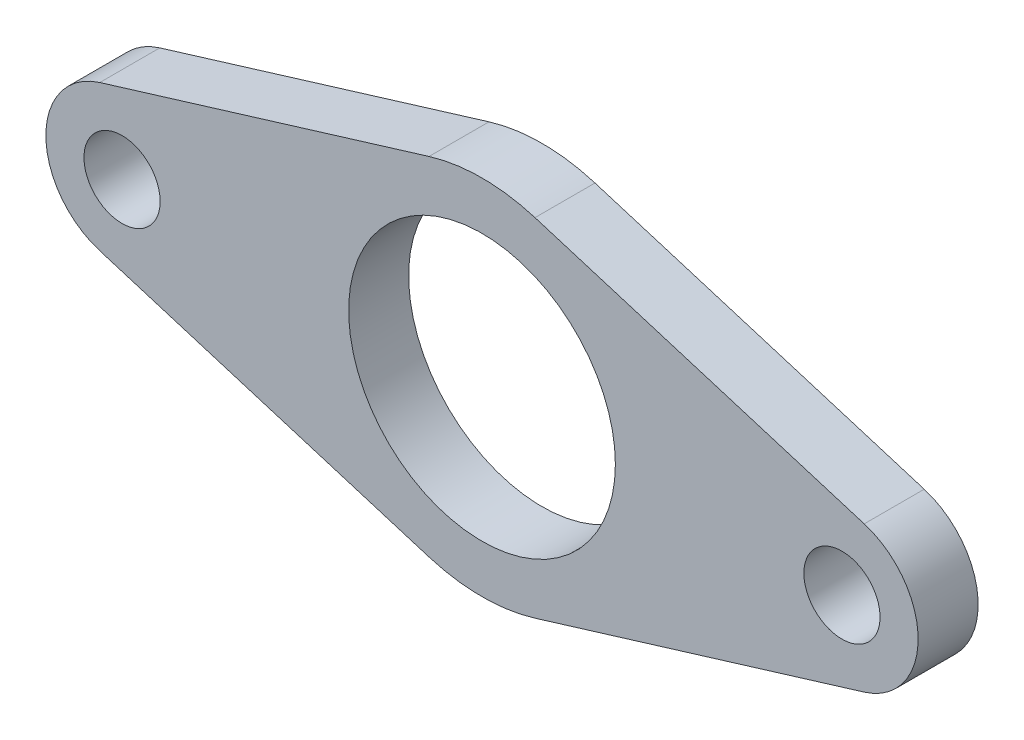
from build123d import *

# Parameters (mm, degrees)
CROQUIS1_R              = 11.115
CROQUIS1_R_2            = 3.175
SALIENTE_EXTRUIR1_DEPTH = 5


with BuildPart() as part:
    # Croquis1 → Saliente-Extruir1 (new body)
    with BuildSketch(Plane.XY):
        with BuildLine():
            Line((-31.855258333, 6.072933107), (-4.416099167, 14.455493528))
            ThreePointArc((-4.416099167, 14.455493528), (0, 15.115), (4.416099167, 14.455493528))
            Line((4.416099167, 14.455493528), (31.855258333, 6.072933107))
            ThreePointArc((31.855258333, 6.072933107), (36.35, 0), (31.855258333, -6.072933107))
            Line((31.855258333, -6.072933107), (4.416099167, -14.455493528))
            ThreePointArc((4.416099167, -14.455493528), (0, -15.115), (-4.416099167, -14.455493528))
            Line((-4.416099167, -14.455493528), (-31.855258333, -6.072933107))
            ThreePointArc((-31.855258333, -6.072933107), (-36.35, 0), (-31.855258333, 6.072933107))
        make_face()
        Circle(CROQUIS1_R, mode=Mode.SUBTRACT)
        with Locations((-30, 0)):
            Circle(CROQUIS1_R_2, mode=Mode.SUBTRACT)
        with Locations(Location((30, 0, 0), (0, 0, 180))):
            Circle(CROQUIS1_R_2, mode=Mode.SUBTRACT)
    extrude(amount=SALIENTE_EXTRUIR1_DEPTH)


solid = part.part
